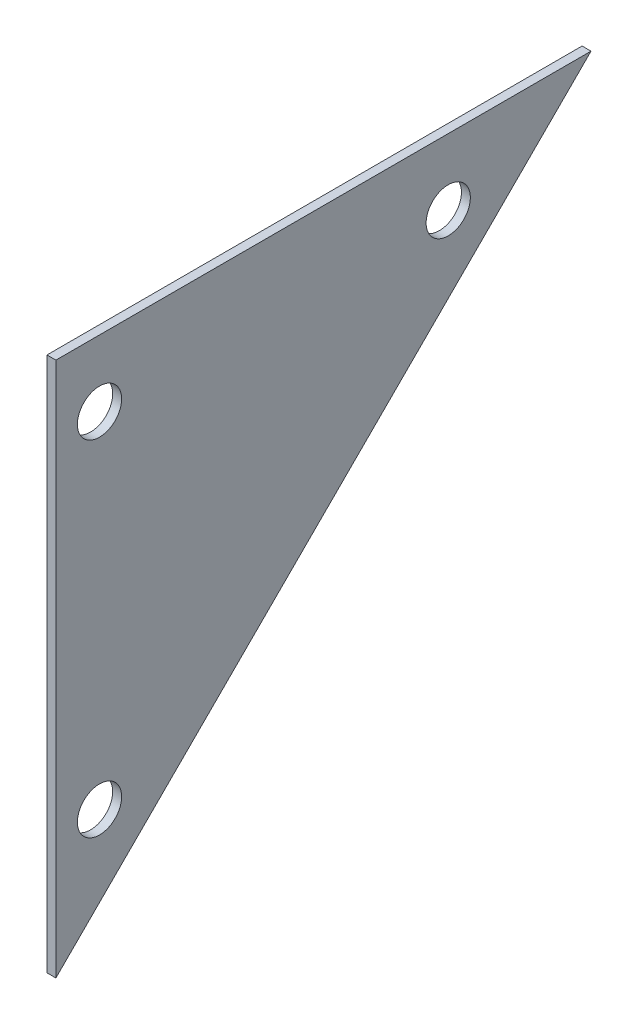
from build123d import *

# Parameters (mm, degrees)
BOSS_EXTRUDE1_DEPTH                            = 2.54
CSK_FOR_M6_FLAT_HEAD_MACHINE_SCREW1_AT_2_COUNT = 2
CSK_FOR_M6_FLAT_HEAD_MACHINE_SCREW1_AT_2_PITCH = 99.31634163
CSK_FOR_M6_FLAT_HEAD_MACHINE_SCREW1_AT_3_COUNT = 2
CSK_FOR_M6_FLAT_HEAD_MACHINE_SCREW1_AT_3_PITCH = 98.119759201


with BuildPart() as part:
    # Sketch1 → Boss-Extrude1 (new body)
    with BuildSketch(Plane(origin=(0, 0, 0), x_dir=(0, 0, -1), z_dir=(1, 0, 0))):
        Polygon((112.940672783, 23.924159021), (-39.459327217, -128.475840979), (-39.459327217, 23.924159021), align=None)
    extrude(amount=BOSS_EXTRUDE1_DEPTH)

    # Sketch3 → CSK for M6 Flat Head Machine Screw1 (revolve, cut)
    with BuildSketch(Plane(origin=(2.54, 5.007497158, 27.039858725), x_dir=(0, 0, -1), z_dir=(0, 1, 0))):
        Polygon((0, 0), (0, 2.54), (3.3, 2.54), (3.3, 28.4), (6.3, 25.4), (6.3, 0), align=None)
    csk_for_m6_flat_head_machine_screw1 = revolve(axis=Axis((8.89, 5.007497158, 27.039858725), (-1, 0, 0)), mode=Mode.SUBTRACT)

    # CSK for M6 Flat Head Machine Screw1 at 2: CSK for M6 Flat Head Machine Screw1 ×2
    with Locations(*[(0, 0, -i * CSK_FOR_M6_FLAT_HEAD_MACHINE_SCREW1_AT_2_PITCH) for i in range(1, CSK_FOR_M6_FLAT_HEAD_MACHINE_SCREW1_AT_2_COUNT)]):
        add(csk_for_m6_flat_head_machine_screw1, mode=Mode.SUBTRACT)

    # CSK for M6 Flat Head Machine Screw1 at 3: CSK for M6 Flat Head Machine Screw1 ×2
    with Locations(*[(0, -i * CSK_FOR_M6_FLAT_HEAD_MACHINE_SCREW1_AT_3_PITCH, 0) for i in range(1, CSK_FOR_M6_FLAT_HEAD_MACHINE_SCREW1_AT_3_COUNT)]):
        add(csk_for_m6_flat_head_machine_screw1, mode=Mode.SUBTRACT)


solid = part.part
